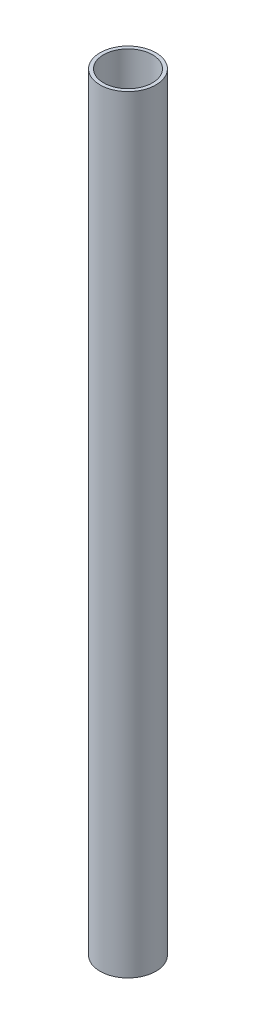
from build123d import *

# Parameters (mm, degrees)
SKETCH1_R           = 50.8
SKETCH1_R_2         = 44.45
BOSS_EXTRUDE1_DEPTH = 1397


with BuildPart() as part:
    # Sketch1 → Boss-Extrude1 (new body)
    with BuildSketch(Plane(origin=(0, 0, 0), x_dir=(1, 0, 0), z_dir=(0, 1, 0))):
        with Locations(Location((0, 0, 0), (0, 0, 270))):
            Circle(SKETCH1_R)
        with Locations(Location((0, 0, 0), (0, 0, 270))):
            Circle(SKETCH1_R_2, mode=Mode.SUBTRACT)
    extrude(amount=BOSS_EXTRUDE1_DEPTH)


solid = part.part
